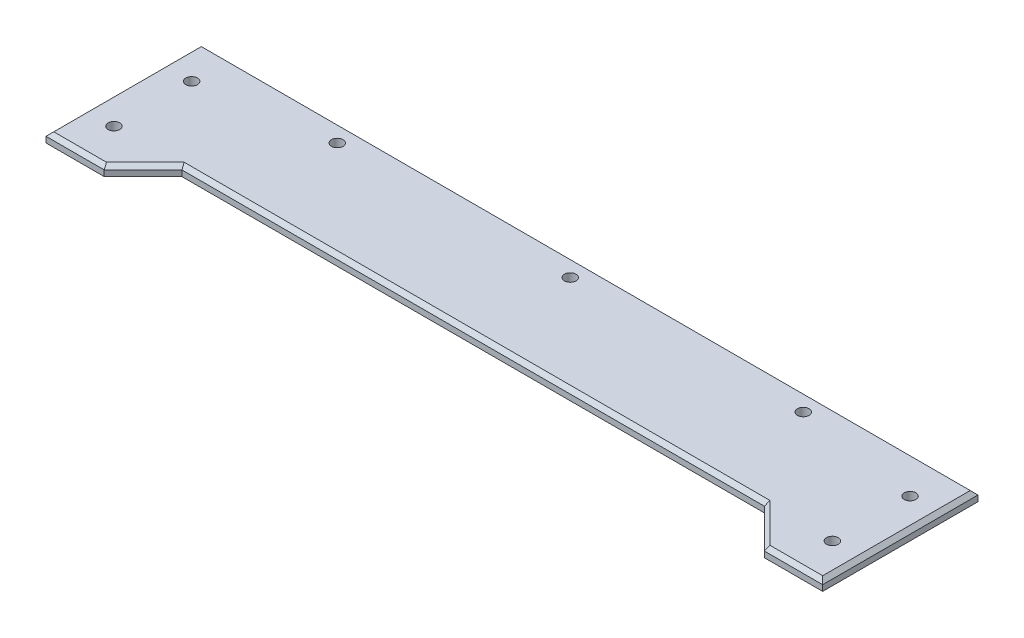
from build123d import *

# Parameters (mm, degrees)
CROQUIS1_R              = 3
SALIENTE_EXTRUIR1_DEPTH = 5
CHAFL_N1_SIZE           = 2


with BuildPart() as part:
    # Croquis1 → Saliente-Extruir1 (new body)
    with BuildSketch(Plane(origin=(0, 0, 0), x_dir=(1, 0, 0), z_dir=(0, 1, 0))):
        Polygon((-149.607843137, -39.607843137), (-129.607843137, -19.607843137), (170.392156863, -19.607843137), (190.392156863, -39.607843137), (220.392156863, -39.607843137), (220.392156863, 40.392156863), (-179.607843137, 40.392156863), (-179.607843137, -39.607843137), align=None)
        with Locations(Location((-164.607843137, 20.392156863, 0), (0, 0, 270))):
            Circle(CROQUIS1_R, mode=Mode.SUBTRACT)
        with Locations(Location((-99.607843137, 30.392156863, 0), (0, 0, 270))):
            Circle(CROQUIS1_R, mode=Mode.SUBTRACT)
        with Locations(Location((140.392156863, 30.392156863, 0), (0, 0, 270))):
            Circle(CROQUIS1_R, mode=Mode.SUBTRACT)
        with Locations(Location((20.392156863, 30.392156863, 0), (0, 0, 270))):
            Circle(CROQUIS1_R, mode=Mode.SUBTRACT)
        with Locations(Location((-164.607843137, -19.607843137, 0), (0, 0, 270))):
            Circle(CROQUIS1_R, mode=Mode.SUBTRACT)
        with Locations(Location((205.392156863, 20.392156863, 0), (0, 0, 270))):
            Circle(CROQUIS1_R, mode=Mode.SUBTRACT)
        with Locations(Location((205.392156863, -19.607843137, 0), (0, 0, 270))):
            Circle(CROQUIS1_R, mode=Mode.SUBTRACT)
    extrude(amount=SALIENTE_EXTRUIR1_DEPTH)

    # Chaflán1
    chafl_n1_edges = [part.edges().sort_by_distance(p)[0] for p in [
        (-139.607843137, 5, 29.607843137),
        (20.392156863, 5, 19.607843137),
        (180.392156863, 5, 29.607843137),
        (205.392156863, 5, 39.607843137),
        (220.392156863, 5, -0.392156863),
        (20.392156863, 5, -40.392156863),
        (-179.607843137, 5, -0.392156863),
        (-164.607843137, 5, 39.607843137),
    ]]
    chamfer(chafl_n1_edges, length=CHAFL_N1_SIZE)


solid = part.part
